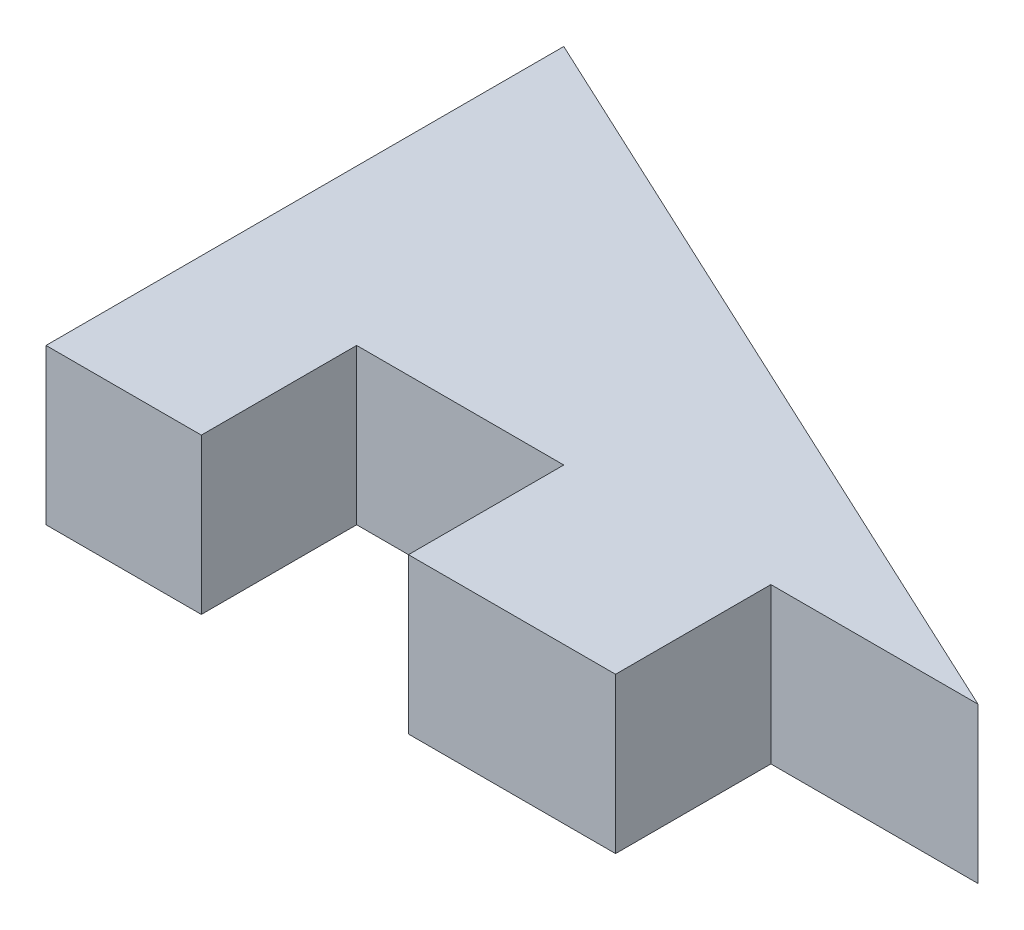
from build123d import *

# Parameters (mm, degrees)
BOSS_EXTRUDE1_DEPTH = 3


with BuildPart() as part:
    # Sketch1 → Boss-Extrude1 (new body)
    with BuildSketch(Plane(origin=(0, 0, 0), x_dir=(1, 0, 0), z_dir=(0, 1, 0))):
        Polygon((-4, 0), (-4, 3), (0, 3), (-15, 10), (-15, 3), (-15, 0), (-12, 0), (-12, 3), (-8, 3), (-8, 0), align=None)
    extrude(amount=BOSS_EXTRUDE1_DEPTH)


solid = part.part
